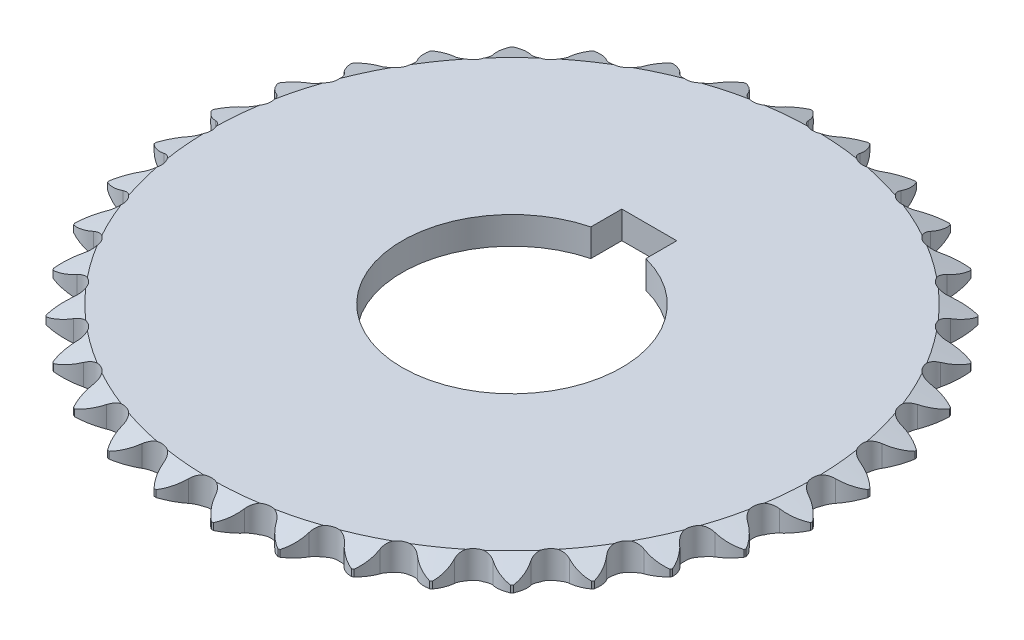
from build123d import *

# Parameters (mm, degrees)
SKETCH1_R                         = 38.1
BASE_CIRCLE_DEPTH                 = 1.5875
TOOTH_PROFILE_CUT_DEPTH           = 54.975
TOOTH_PROFILE_CUT_PATTERN_COUNT   = 36
SHAFT_HOLE_WITH_KEYWAY_DEPTH      = 54.784533592
SHAFT_HOLE_WITH_KEYWAY_DEPTH_BACK = 54.784533592


with BuildPart() as part:
    # Sketch1 → Base Circle (new, symmetric)
    with BuildSketch(Plane(origin=(0, 0, 0), x_dir=(1, 0, 0), z_dir=(0, 1, 0))):
        with Locations(Location((0, 0, 0), (0, 0, 270))):
            Circle(SKETCH1_R)
    extrude(amount=BASE_CIRCLE_DEPTH, both=True)

    # Sketch2 → Tooth Profile Cut (cut, symmetric)
    with BuildSketch(Plane(origin=(0, 1.5875, 0), x_dir=(1, 0, 0), z_dir=(0, 1, 0))):
        with BuildLine():
            ThreePointArc((3.203481478, 37.96508536), (0, 38.1), (-3.203481478, 37.96508536))
            ThreePointArc((-3.203481478, 37.96508536), (-2.241792284, 37.019193784), (-1.58476719, 35.841112716))
            ThreePointArc((-1.58476719, 35.841112716), (0, 34.751645), (1.58476719, 35.841112716))
            ThreePointArc((1.58476719, 35.841112716), (2.241792284, 37.019193784), (3.203481478, 37.96508536))
        make_face()
    tooth_profile_cut = extrude(amount=TOOTH_PROFILE_CUT_DEPTH, both=True, mode=Mode.SUBTRACT)

    # Tooth Profile Cut Pattern: Tooth Profile Cut ×36 about axis
    tooth_profile_cut_pattern_axis = Axis((0, 0, 0), (0, 1, 0))
    for i in range(1, TOOTH_PROFILE_CUT_PATTERN_COUNT):
        add(tooth_profile_cut.rotate(tooth_profile_cut_pattern_axis, i * 360 / TOOTH_PROFILE_CUT_PATTERN_COUNT), mode=Mode.SUBTRACT)

    # Sketch3 → Tooth Chamfer (revolve, cut)
    with BuildSketch(Plane(origin=(0, 0, 0), x_dir=(0, 0, -1), z_dir=(1, 0, 0))):
        Polygon((38.1, -0.396875), (34.925, -1.5875), (38.1, -1.5875), align=None)
        Polygon((34.925, 1.5875), (38.1, 0.396875), (38.1, 1.5875), align=None)
    revolve(axis=Axis((0, 1.5875, 0), (0, -1, 0)), mode=Mode.SUBTRACT)

    # Sketch4 → Shaft hole with keyway (cut, two sides: drawn at the far end of the back side and taken through both)
    with BuildSketch(Plane(origin=(0, 1.5875, 0), x_dir=(1, 0, 0), z_dir=(0, 1, 0)).offset(-SHAFT_HOLE_WITH_KEYWAY_DEPTH_BACK)):
        with BuildLine():
            Line((0, 15.875), (-3.175, 15.875))
            Line((-3.175, 15.875), (-3.175, 12.296722124))
            ThreePointArc((-3.175, 12.296722124), (0, -12.7), (3.175, 12.296722124))
            Line((3.175, 12.296722124), (3.175, 15.875))
            Line((3.175, 15.875), (0, 15.875))
        make_face()
    extrude(amount=SHAFT_HOLE_WITH_KEYWAY_DEPTH + SHAFT_HOLE_WITH_KEYWAY_DEPTH_BACK, mode=Mode.SUBTRACT)


solid = part.part
